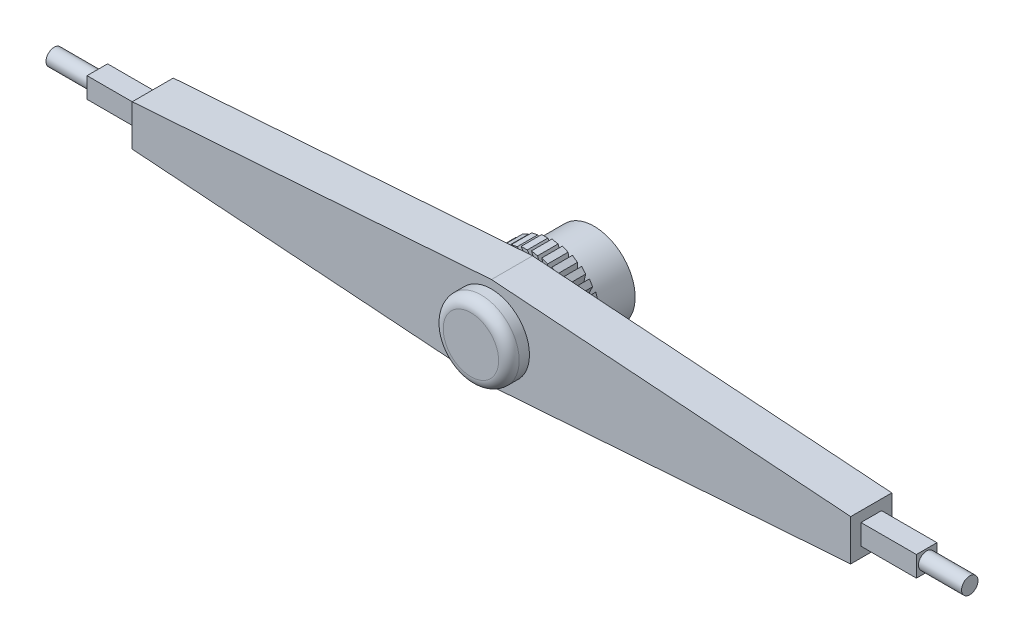
from build123d import *

# Parameters (mm, degrees)
BOSS_EXTRUDE1_DEPTH = 20
SKETCH2_R           = 20
BOSS_EXTRUDE2_DEPTH = 30
SKETCH3_R           = 18.5
BOSS_EXTRUDE3_DEPTH = 10
FILLET1_R           = 5
SKETCH4_W           = 10
SKETCH4_H           = 10
BOSS_EXTRUDE4_DEPTH = 27
SKETCH5_R           = 4
BOSS_EXTRUDE5_DEPTH = 21
BOSS_EXTRUDE6_START = -30
BOSS_EXTRUDE6_DEPTH = 10


with BuildPart() as part:
    # Sketch1 → Boss-Extrude1 (new body)
    with BuildSketch(Plane.XY):
        Polygon((0, -22.5), (0, 22.5), (-3.197969543, 22.271573604), (-175, 10), (-175, -10), (-3.197969543, -22.271573604), align=None)
        Polygon((3.197969543, 22.271573604), (0, 22.5), (0, -22.5), (3.197969543, -22.271573604), (175, -10), (175, 10), align=None)
    extrude(amount=BOSS_EXTRUDE1_DEPTH)

    # Sketch2 → Boss-Extrude2 (add)
    with BuildSketch(Plane(origin=(0, 0, 0), x_dir=(-1, 0, 0), z_dir=(0, 0, -1))):
        with Locations(Location((0, 0, 0), (0, 0, 180))):
            Circle(SKETCH2_R)
    extrude(amount=BOSS_EXTRUDE2_DEPTH)

    # Sketch3 → Boss-Extrude3 (add)
    with BuildSketch(Plane.XY.offset(20)):
        Circle(SKETCH3_R)
    extrude(amount=BOSS_EXTRUDE3_DEPTH)

    # Fillet1
    fillet1_edges = [part.edges().sort_by_distance(p)[0] for p in [
        (-18.5, 0, 30),
    ]]
    fillet(fillet1_edges, radius=FILLET1_R)

    # Sketch4 → Boss-Extrude4 (add)
    with BuildSketch(Plane(origin=(175, 0, 0), x_dir=(0, 0, -1), z_dir=(1, 0, 0))):
        with Locations((-10, 0)):
            Rectangle(SKETCH4_W, SKETCH4_H)
    boss_extrude4 = extrude(amount=BOSS_EXTRUDE4_DEPTH)

    # Sketch5 → Boss-Extrude5 (add)
    with BuildSketch(Plane(origin=(202, 0, 0), x_dir=(0, 0, -1), z_dir=(1, 0, 0))):
        with Locations((-10, 0)):
            Circle(SKETCH5_R)
    boss_extrude5 = extrude(amount=BOSS_EXTRUDE5_DEPTH)

    # Mirror1: Boss-Extrude4, Boss-Extrude5 across plane
    add(boss_extrude4.mirror(Plane(origin=(0, 0, 0), x_dir=(0, 0, 1), z_dir=(1, 0, 0))))
    add(boss_extrude5.mirror(Plane(origin=(0, 0, 0), x_dir=(0, 0, 1), z_dir=(1, 0, 0))))

    # Sketch6 → Boss-Extrude6 (add)
    with BuildSketch(Plane(origin=(0, 0, -30), x_dir=(-1, 0, 0), z_dir=(0, 0, -1)).offset(BOSS_EXTRUDE6_START)):
        with BuildLine():
            Line((0, -20), (-2.552111814, -23.70630885))
            Line((-2.552111814, -23.70630885), (-5.552111814, -23.70630885))
            Line((-5.552111814, -23.70630885), (-2.858602752, -19.7946556))
            ThreePointArc((-2.858602752, -19.7946556), (-1.4329843, -19.948597845), (0, -20))
        make_face()
        with BuildLine():
            Line((-10.359603606, -22.033920169), (-6.911675738, -18.76775795))
            ThreePointArc((-6.911675738, -18.76775795), (-5.549216863, -19.214738932), (-4.158233816, -19.562952015))
            Line((-4.158233816, -19.562952015), (-7.425160804, -22.657655241))
            Line((-7.425160804, -22.657655241), (-10.359603606, -22.033920169))
        make_face()
        with BuildLine():
            Line((-14.714331009, -19.398543446), (-10.662675329, -16.920619221))
            ThreePointArc((-10.662675329, -16.920619221), (-9.42292202, -17.641103724), (-8.134732862, -18.270909153))
            Line((-8.134732862, -18.270909153), (-11.973694636, -20.618753375))
            Line((-11.973694636, -20.618753375), (-14.714331009, -19.398543446))
        make_face()
        with BuildLine():
            Line((-18.42597154, -15.91535729), (-13.947664842, -14.333968238))
            ThreePointArc((-13.947664842, -14.333968238), (-12.884800269, -15.296467632), (-11.755705046, -16.180339887))
            Line((-11.755705046, -16.180339887), (-15.998920557, -17.678713047))
            Line((-15.998920557, -17.678713047), (-18.42597154, -15.91535729))
        make_face()
        with BuildLine():
            Line((-21.332308697, -11.73659365), (-16.623074474, -11.120854061))
            ThreePointArc((-16.623074474, -11.120854061), (-15.783550918, -12.283302505), (-14.86289651, -13.382612127))
            Line((-14.86289651, -13.382612127), (-19.324916878, -13.966028126))
            Line((-19.324916878, -13.966028126), (-21.332308697, -11.73659365))
        make_face()
        with BuildLine():
            Line((-23.306321601, -7.044884549), (-18.571975985, -7.421705197))
            ThreePointArc((-18.571975985, -7.421705197), (-17.992484654, -8.733298115), (-17.320508076, -10))
            Line((-17.320508076, -10), (-21.806321601, -9.64296076))
            Line((-21.806321601, -9.64296076), (-23.306321601, -7.044884549))
        make_face()
        with BuildLine():
            Line((-24.261736414, -2.045280188), (-19.709193026, -3.398192203))
            ThreePointArc((-19.709193026, -3.398192203), (-19.415060473, -4.801606692), (-19.021130326, -6.180339887))
            Line((-19.021130326, -6.180339887), (-23.334685431, -4.898449737))
            Line((-23.334685431, -4.898449737), (-24.261736414, -2.045280188))
        make_face()
        with BuildLine():
            Line((-24.156796925, 3.043712731), (-19.985023758, 0.773838097))
            ThreePointArc((-19.985023758, 0.773838097), (-19.989104986, -0.660062015), (-19.890437907, -2.090569265))
            Line((-19.890437907, -2.090569265), (-23.843211535, 0.060147045))
            Line((-23.843211535, 0.060147045), (-24.156796925, 3.043712731))
        make_face()
        with BuildLine():
            Line((-22.996089493, 7.999680799), (-19.387413052, 4.912047958))
            ThreePointArc((-19.387413052, 4.912047958), (-19.689529692, 3.510330539), (-19.890437907, 2.090569265))
            Line((-19.890437907, 2.090569265), (-23.309674883, 5.016115112))
            Line((-23.309674883, 5.016115112), (-22.996089493, 7.999680799))
        make_face()
        with BuildLine():
            Line((-20.830342603, 12.606024428), (-17.942479365, 8.835577753))
            ThreePointArc((-17.942479365, 8.835577753), (-18.52942747, 7.527304805), (-19.021130326, 6.180339887))
            Line((-19.021130326, 6.180339887), (-21.757393587, 9.75285488))
            Line((-21.757393587, 9.75285488), (-20.830342603, 12.606024428))
        make_face()
        with BuildLine():
            Line((-17.754209787, 16.6614243), (-15.713373232, 12.372950403))
            ThreePointArc((-15.713373232, 12.372950403), (-16.559500354, 11.21529973), (-17.320508076, 10))
            Line((-17.320508076, 10), (-19.254209787, 14.063348089))
            Line((-19.254209787, 14.063348089), (-17.754209787, 16.6614243))
        make_face()
        with BuildLine():
            Line((-13.902132808, 19.98863998), (-12.797517288, 15.369565747))
            ThreePointArc((-12.797517288, 15.369565747), (-13.865843611, 14.41313224), (-14.86289651, 13.382612127))
            Line((-14.86289651, 13.382612127), (-15.909524627, 17.759205504))
            Line((-15.909524627, 17.759205504), (-13.902132808, 19.98863998))
        make_face()
        with BuildLine():
            Line((-9.442465916, 22.442256177), (-9.322348429, 17.694457318))
            ThreePointArc((-9.322348429, 17.694457318), (-10.566182966, 16.981041709), (-11.755705046, 16.180339887))
            Line((-11.755705046, 16.180339887), (-11.869516899, 20.67890042))
            Line((-11.869516899, 20.67890042), (-9.442465916, 22.442256177))
        make_face()
        with BuildLine():
            Line((-4.570117953, 23.915038088), (-5.43974821, 19.246016196))
            ThreePointArc((-5.43974821, 19.246016196), (-6.804729423, 18.806798172), (-8.134732862, 18.270909153))
            Line((-8.134732862, 18.270909153), (-7.310754326, 22.694828159))
            Line((-7.310754326, 22.694828159), (-4.570117953, 23.915038088))
        make_face()
        with BuildLine():
            Line((0.501966094, 24.342618078), (-1.319404891, 19.956431814))
            ThreePointArc((-1.319404891, 19.956431814), (-2.745876552, 19.810607309), (-4.158233816, 19.562952015))
            Line((-4.158233816, 19.562952015), (-2.432476708, 23.718883006))
            Line((-2.432476708, 23.718883006), (0.501966094, 24.342618078))
        make_face()
        with BuildLine():
            Line((5.552111814, 23.70630885), (2.858602752, 19.7946556))
            ThreePointArc((2.858602752, 19.7946556), (1.4329843, 19.948597845), (0, 20))
            Line((0, 20), (2.552111814, 23.70630885))
            Line((2.552111814, 23.70630885), (5.552111814, 23.70630885))
        make_face()
        with BuildLine():
            Line((10.359603606, 22.033920169), (6.911675738, 18.76775795))
            ThreePointArc((6.911675738, 18.76775795), (5.549216863, 19.214738932), (4.158233816, 19.562952015))
            Line((4.158233816, 19.562952015), (7.425160804, 22.657655241))
            Line((7.425160804, 22.657655241), (10.359603606, 22.033920169))
        make_face()
        with BuildLine():
            Line((14.714331009, 19.398543446), (10.662675329, 16.920619221))
            ThreePointArc((10.662675329, 16.920619221), (9.42292202, 17.641103724), (8.134732862, 18.270909153))
            Line((8.134732862, 18.270909153), (11.973694636, 20.618753375))
            Line((11.973694636, 20.618753375), (14.714331009, 19.398543446))
        make_face()
        with BuildLine():
            Line((18.42597154, 15.91535729), (13.947664842, 14.333968238))
            ThreePointArc((13.947664842, 14.333968238), (12.884800269, 15.296467632), (11.755705046, 16.180339887))
            Line((11.755705046, 16.180339887), (15.998920557, 17.678713047))
            Line((15.998920557, 17.678713047), (18.42597154, 15.91535729))
        make_face()
        with BuildLine():
            Line((21.332308697, 11.73659365), (16.623074474, 11.120854061))
            ThreePointArc((16.623074474, 11.120854061), (15.783550918, 12.283302505), (14.86289651, 13.382612127))
            Line((14.86289651, 13.382612127), (19.324916878, 13.966028126))
            Line((19.324916878, 13.966028126), (21.332308697, 11.73659365))
        make_face()
        with BuildLine():
            Line((23.306321601, 7.044884549), (18.571975985, 7.421705197))
            ThreePointArc((18.571975985, 7.421705197), (17.992484654, 8.733298115), (17.320508076, 10))
            Line((17.320508076, 10), (21.806321601, 9.64296076))
            Line((21.806321601, 9.64296076), (23.306321601, 7.044884549))
        make_face()
        with BuildLine():
            Line((24.261736414, 2.045280188), (19.709193026, 3.398192203))
            ThreePointArc((19.709193026, 3.398192203), (19.415060473, 4.801606692), (19.021130326, 6.180339887))
            Line((19.021130326, 6.180339887), (23.334685431, 4.898449737))
            Line((23.334685431, 4.898449737), (24.261736414, 2.045280188))
        make_face()
        with BuildLine():
            Line((24.156796925, -3.043712731), (19.985023758, -0.773838097))
            ThreePointArc((19.985023758, -0.773838097), (19.989104986, 0.660062015), (19.890437907, 2.090569265))
            Line((19.890437907, 2.090569265), (23.843211535, -0.060147045))
            Line((23.843211535, -0.060147045), (24.156796925, -3.043712731))
        make_face()
        with BuildLine():
            Line((22.996089493, -7.999680799), (19.387413052, -4.912047958))
            ThreePointArc((19.387413052, -4.912047958), (19.689529692, -3.510330539), (19.890437907, -2.090569265))
            Line((19.890437907, -2.090569265), (23.309674883, -5.016115112))
            Line((23.309674883, -5.016115112), (22.996089493, -7.999680799))
        make_face()
        with BuildLine():
            Line((20.830342603, -12.606024428), (17.942479365, -8.835577753))
            ThreePointArc((17.942479365, -8.835577753), (18.52942747, -7.527304805), (19.021130326, -6.180339887))
            Line((19.021130326, -6.180339887), (21.757393587, -9.75285488))
            Line((21.757393587, -9.75285488), (20.830342603, -12.606024428))
        make_face()
        with BuildLine():
            Line((17.754209787, -16.6614243), (15.713373232, -12.372950403))
            ThreePointArc((15.713373232, -12.372950403), (16.559500354, -11.21529973), (17.320508076, -10))
            Line((17.320508076, -10), (19.254209787, -14.063348089))
            Line((19.254209787, -14.063348089), (17.754209787, -16.6614243))
        make_face()
        with BuildLine():
            Line((13.902132808, -19.98863998), (12.797517288, -15.369565747))
            ThreePointArc((12.797517288, -15.369565747), (13.865843611, -14.41313224), (14.86289651, -13.382612127))
            Line((14.86289651, -13.382612127), (15.909524627, -17.759205504))
            Line((15.909524627, -17.759205504), (13.902132808, -19.98863998))
        make_face()
        with BuildLine():
            Line((9.442465916, -22.442256177), (9.322348429, -17.694457318))
            ThreePointArc((9.322348429, -17.694457318), (10.566182966, -16.981041709), (11.755705046, -16.180339887))
            Line((11.755705046, -16.180339887), (11.869516899, -20.67890042))
            Line((11.869516899, -20.67890042), (9.442465916, -22.442256177))
        make_face()
        with BuildLine():
            Line((4.570117953, -23.915038088), (5.43974821, -19.246016196))
            ThreePointArc((5.43974821, -19.246016196), (6.804729423, -18.806798172), (8.134732862, -18.270909153))
            Line((8.134732862, -18.270909153), (7.310754326, -22.694828159))
            Line((7.310754326, -22.694828159), (4.570117953, -23.915038088))
        make_face()
        with BuildLine():
            Line((-0.501966094, -24.342618078), (1.319404891, -19.956431814))
            ThreePointArc((1.319404891, -19.956431814), (2.745876552, -19.810607309), (4.158233816, -19.562952015))
            Line((4.158233816, -19.562952015), (2.432476708, -23.718883006))
            Line((2.432476708, -23.718883006), (-0.501966094, -24.342618078))
        make_face()
    extrude(amount=BOSS_EXTRUDE6_DEPTH)


solid = part.part
